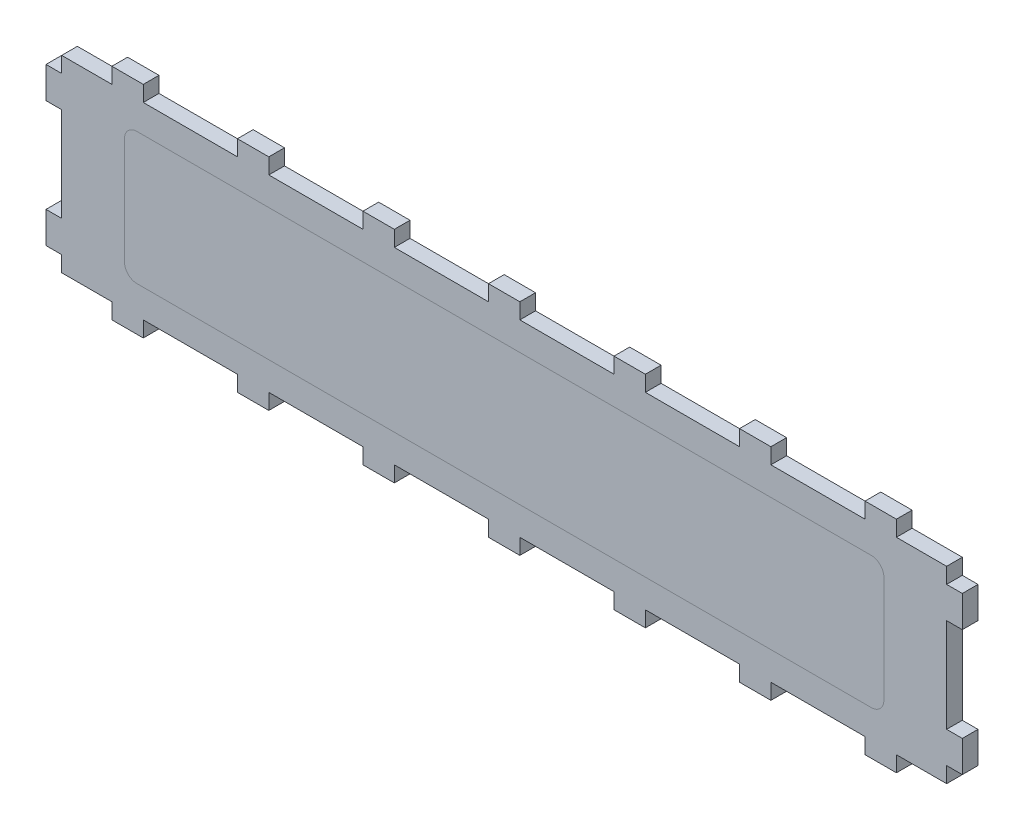
from build123d import *

# Parameters (mm, degrees)
BOSS_EXTRUDE1_DEPTH = 2.5
BOSS_EXTRUDE2_DEPTH = 2.5


with BuildPart() as part:
    # Sketch1 → Boss-Extrude1 (new body)
    with BuildSketch(Plane.XY):
        Polygon((-73, -12.5), (-70.5, -12.5), (-70.5, -15), (-62.5, -15), (-62.5, -17.5), (-57.5, -17.5), (-57.5, -15), (-42.5, -15), (-42.5, -17.5), (-37.5, -17.5), (-37.5, -15), (-22.5, -15), (-22.5, -17.5), (-17.5, -17.5), (-17.5, -15), (-2.5, -15), (-2.5, -17.5), (2.5, -17.5), (2.5, -15), (17.5, -15), (17.5, -17.5), (22.5, -17.5), (22.5, -15), (37.5, -15), (37.5, -17.5), (42.5, -17.5), (42.5, -15), (57.5, -15), (57.5, -17.5), (62.5, -17.5), (62.5, -15), (70.5, -15), (70.5, -12.5), (73, -12.5), (73, -7.5), (70.5, -7.5), (70.5, 7.5), (73, 7.5), (73, 12.5), (70.5, 12.5), (70.5, 15), (62.5, 15), (62.5, 17.5), (57.5, 17.5), (57.5, 15), (42.5, 15), (42.5, 17.5), (37.5, 17.5), (37.5, 15), (22.5, 15), (22.5, 17.5), (17.5, 17.5), (17.5, 15), (2.5, 15), (2.5, 17.5), (-2.5, 17.5), (-2.5, 15), (-17.5, 15), (-17.5, 17.5), (-22.5, 17.5), (-22.5, 15), (-37.5, 15), (-37.5, 17.5), (-42.5, 17.5), (-42.5, 15), (-57.5, 15), (-57.5, 17.5), (-62.5, 17.5), (-62.5, 15), (-70.5, 15), (-70.5, 12.5), (-73, 12.5), (-73, 7.5), (-70.5, 7.5), (-70.5, -7.5), (-73, -7.5), align=None)
        with BuildLine():
            Line((58.5, -10.5), (-58.5, -10.5))
            ThreePointArc((-58.5, -10.5), (-59.914213562, -9.914213562), (-60.5, -8.5))
            Line((-60.5, -8.5), (-60.5, 8.5))
            ThreePointArc((-60.5, 8.5), (-59.914213562, 9.914213562), (-58.5, 10.5))
            Line((-58.5, 10.5), (58.5, 10.5))
            ThreePointArc((58.5, 10.5), (59.914213562, 9.914213562), (60.5, 8.5))
            Line((60.5, 8.5), (60.5, -8.5))
            ThreePointArc((60.5, -8.5), (59.914213562, -9.914213562), (58.5, -10.5))
        make_face(mode=Mode.SUBTRACT)
    extrude(amount=BOSS_EXTRUDE1_DEPTH)


with BuildPart() as body_2:
    # Sketch1<3> → Boss-Extrude2 (new body)
    with BuildSketch(Plane.XY):
        with BuildLine():
            ThreePointArc((-60.5, -8.5), (-59.914213562, -9.914213562), (-58.5, -10.5))
            Line((-58.5, -10.5), (58.5, -10.5))
            ThreePointArc((58.5, -10.5), (59.914213562, -9.914213562), (60.5, -8.5))
            Line((60.5, -8.5), (60.5, 8.5))
            ThreePointArc((60.5, 8.5), (59.914213562, 9.914213562), (58.5, 10.5))
            Line((58.5, 10.5), (-58.5, 10.5))
            ThreePointArc((-58.5, 10.5), (-59.914213562, 9.914213562), (-60.5, 8.5))
            Line((-60.5, 8.5), (-60.5, -8.5))
        make_face()
    extrude(amount=BOSS_EXTRUDE2_DEPTH)


solid = Compound([part.part, body_2.part])
